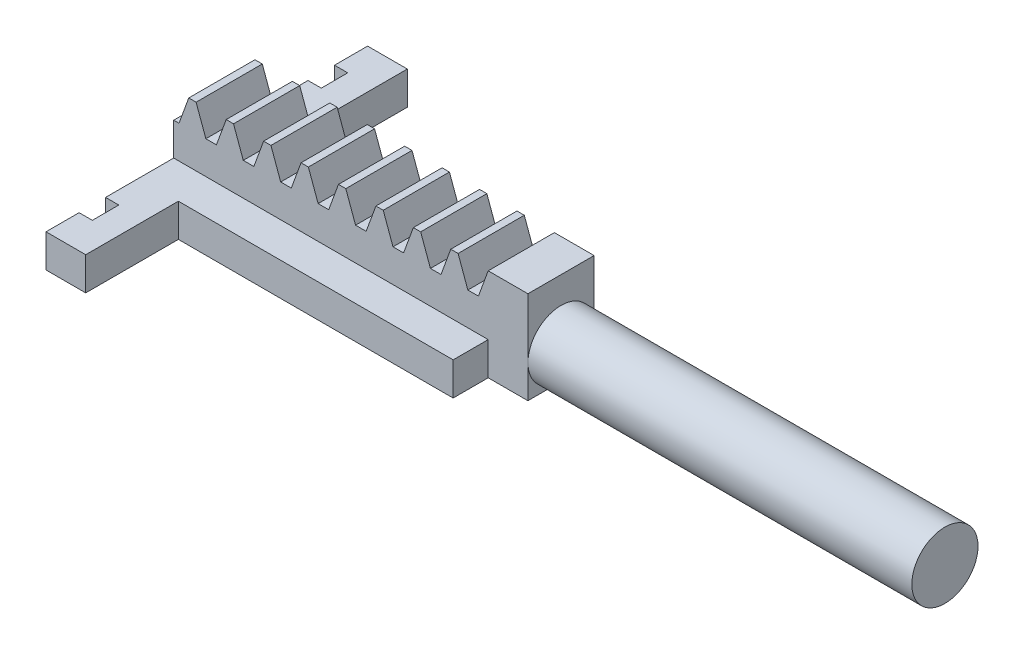
from build123d import *

# Parameters (mm, degrees)
BLANKSKE_W          = 23.757
BLANKSKE_H          = 7
BLANK_DEPTH         = 5
TOOTHCUTSIM_DEPTH   = 26.26648074
TEETHCUTS_COUNT     = 9
TEETHCUTS_PITCH     = 2.827433385
SKETCH1_R           = 2.5
BOSS_EXTRUDE1_DEPTH = 32
SKETCH2_W           = 2.647496805
SKETCH2_H           = 2.5
BOSS_EXTRUDE2_DEPTH = 23.757
SKETCH3_W           = 5
SKETCH3_H           = 7
BOSS_EXTRUDE3_DEPTH = 3
SKETCH4_W           = 3
SKETCH4_H           = 2.5
BOSS_EXTRUDE4_DEPTH = 7
SKETCH5_W           = 2
SKETCH5_H           = 2.5
CUT_EXTRUDE1_DEPTH  = 1


with BuildPart() as part:
    # BlankSke → Blank (new body)
    with BuildSketch(Plane.XY):
        with Locations((11.8785, 3.5)):
            Rectangle(BLANKSKE_W, BLANKSKE_H)
    extrude(amount=-BLANK_DEPTH)

    # TooCutSkeSim → ToothCutSim (cut, through all)
    with BuildSketch(Plane.XY):
        Polygon((0.399391833, 4.975), (-0.399391833, 4.975), (-1.145676401, 7.0254), (1.145676401, 7.0254), align=None)
    toothcutsim = extrude(amount=-TOOTHCUTSIM_DEPTH, mode=Mode.SUBTRACT)

    # TeethCuts: ToothCutSim ×9
    with Locations(*[(i * TEETHCUTS_PITCH, 0, 0) for i in range(1, TEETHCUTS_COUNT)]):
        add(toothcutsim, mode=Mode.SUBTRACT)

    # Sketch1 → Boss-Extrude1 (add)
    with BuildSketch(Plane(origin=(23.757, 0, 0), x_dir=(0, 0, -1), z_dir=(1, 0, 0))):
        with Locations((2.5, 2.4875)):
            Circle(SKETCH1_R)
    extrude(amount=BOSS_EXTRUDE1_DEPTH)

    # Sketch2 → Boss-Extrude2 (add)
    with BuildSketch(Plane.ZY):
        with Locations((-6.323748402, 1.25)):
            Rectangle(SKETCH2_W, SKETCH2_H)
        with Locations((1.323748403, 1.25)):
            Rectangle(SKETCH2_W, SKETCH2_H)
    extrude(amount=-BOSS_EXTRUDE2_DEPTH)

    # Sketch3 → Boss-Extrude3 (add)
    with BuildSketch(Plane(origin=(23.757, 0, 0), x_dir=(0, 0, -1), z_dir=(1, 0, 0))):
        with Locations((2.5, 3.5)):
            Rectangle(SKETCH3_W, SKETCH3_H)
    extrude(amount=BOSS_EXTRUDE3_DEPTH)

    # Sketch4 → Boss-Extrude4 (add)
    with BuildSketch(Plane(origin=(0, 0, -7.647496805), x_dir=(-1, 0, 0), z_dir=(0, 0, -1))):
        with Locations((-1.5, 1.25)):
            Rectangle(SKETCH4_W, SKETCH4_H)
    boss_extrude4 = extrude(amount=BOSS_EXTRUDE4_DEPTH)

    # Mirror1: Boss-Extrude4 across plane
    add(boss_extrude4.mirror(Plane(origin=(0, 0, -2.5), x_dir=(1, 0, 0), z_dir=(0, 0, -1))))

    # Sketch5 → Cut-Extrude1 (cut)
    with BuildSketch(Plane.ZY):
        with Locations((-11.147496805, 1.25)):
            Rectangle(SKETCH5_W, SKETCH5_H)
    cut_extrude1 = extrude(amount=-CUT_EXTRUDE1_DEPTH, mode=Mode.SUBTRACT)

    # Mirror2: Cut-Extrude1 across plane
    add(cut_extrude1.mirror(Plane(origin=(0, 0, -2.5), x_dir=(1, 0, 0), z_dir=(0, 0, -1))), mode=Mode.SUBTRACT)


solid = part.part
